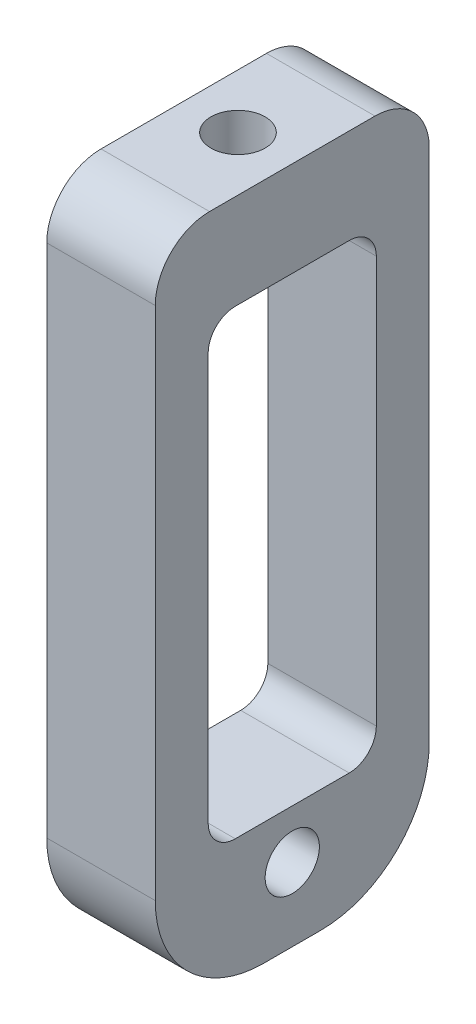
from build123d import *

# Parameters (mm, degrees)
SKETCH21_W          = 4
SKETCH21_H          = 10.1
BOSS_EXTRUDE1_DEPTH = 25
SKETCH22_R          = 1
CUT_EXTRUDE4_DEPTH  = 4
SKETCH23_W          = 6.2
SKETCH23_H          = 17
CUT_EXTRUDE5_DEPTH  = 4
SKETCH24_R          = 1
CUT_EXTRUDE6_DEPTH  = 3.5
FILLET4_R           = 4
FILLET5_R           = 2
FILLET6_R           = 1


with BuildPart() as part:
    # Sketch21 → Boss-Extrude1 (new body)
    with BuildSketch(Plane(origin=(0, 0, 0), x_dir=(1, 0, 0), z_dir=(0, 1, 0))):
        Rectangle(SKETCH21_W, SKETCH21_H)
    extrude(amount=BOSS_EXTRUDE1_DEPTH)

    # Sketch22 → Cut-Extrude4 (cut)
    with BuildSketch(Plane.ZY.offset(2)):
        with Locations((0, 2.7)):
            Circle(SKETCH22_R)
    extrude(amount=-CUT_EXTRUDE4_DEPTH, mode=Mode.SUBTRACT)

    # Sketch23 → Cut-Extrude5 (cut)
    with BuildSketch(Plane.ZY.offset(2)):
        with Locations((0, 13)):
            Rectangle(SKETCH23_W, SKETCH23_H)
    extrude(amount=-CUT_EXTRUDE5_DEPTH, mode=Mode.SUBTRACT)

    # Sketch24 → Cut-Extrude6 (cut)
    with BuildSketch(Plane(origin=(0, 25, 0), x_dir=(1, 0, 0), z_dir=(0, 1, 0))):
        with Locations(Location((0, 0, 0), (0, 0, 270))):
            Circle(SKETCH24_R)
    extrude(amount=-CUT_EXTRUDE6_DEPTH, mode=Mode.SUBTRACT)

    # Fillet4
    fillet4_edges = [part.edges().sort_by_distance(p)[0] for p in [
        (0, 0, 5.05),
        (0, 0, -5.05),
    ]]
    fillet(fillet4_edges, radius=FILLET4_R)

    # Fillet5
    fillet5_edges = [part.edges().sort_by_distance(p)[0] for p in [
        (0, 25, 5.05),
        (0, 25, -5.05),
    ]]
    fillet(fillet5_edges, radius=FILLET5_R)

    # Fillet6
    fillet6_edges = [part.edges().sort_by_distance(p)[0] for p in [
        (0, 21.5, 3.1),
        (0, 4.5, 3.1),
        (0, 4.5, -3.1),
        (0, 21.5, -3.1),
    ]]
    fillet(fillet6_edges, radius=FILLET6_R)


solid = part.part
